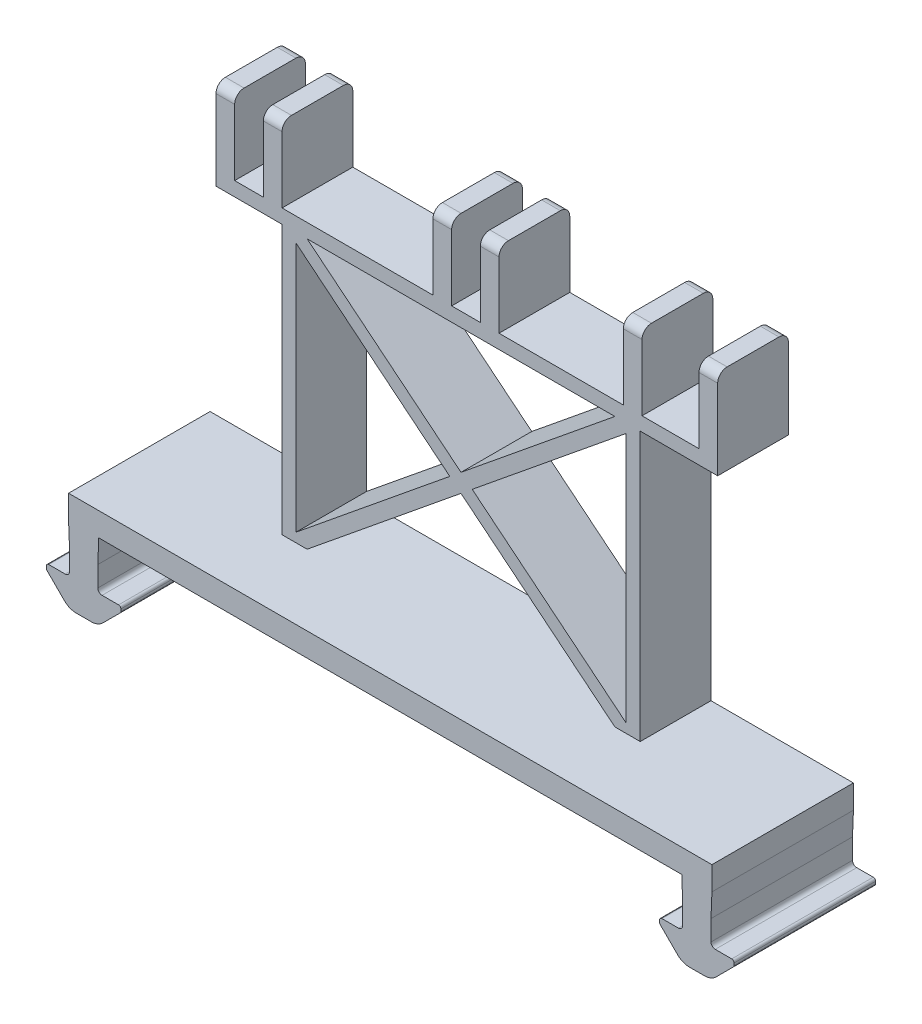
from build123d import *

# Parameters (mm, degrees)
BOSS_EXTRUDE2_DEPTH  = 38.1
BOSS_EXTRUDE6_DEPTH  = 19.05
SKETCH6_W            = 5.08
SKETCH6_H            = 19.05
BOSS_EXTRUDE5_DEPTH  = 20.32
SKETCH10_W           = 20.64004
SKETCH10_H           = 3.81
SKETCH10_W_2         = 17.5006
CUT_EXTRUDE3_DEPTH   = 19.05
FILLET1_R            = 2.54
BOSS_EXTRUDE7_DEPTH  = 19.05
CLEARANCE_START      = -38.1
SKETCH3_W            = 7.73176
SKETCH3_H            = 20.32
SKETCH3_W_2          = 7.7216
SKETCH3_W_3          = 15.3416
CLEARANCE_TRIM_DEPTH = 38.1


with BuildPart() as part:
    # Sketch1 → Boss-Extrude2 (new body)
    with BuildSketch(Plane.XY):
        with BuildLine():
            Line((-2.016886463, 6.858), (2.016886463, 6.858))
            ThreePointArc((2.016886463, 6.858), (3.83455623, 7.219556996), (5.375502252, 8.249184211))
            Line((5.375502252, 8.249184211), (10.026617928, 12.900299887))
            ThreePointArc((10.026617928, 12.900299887), (10.219328904, 13.188712244), (10.287, 13.528917816))
            Line((10.287, 13.528917816), (10.287, 14.097877816))
            ThreePointArc((10.287, 14.097877816), (10.026617928, 14.726495744), (9.398, 14.986877816))
            Line((9.398, 14.986877816), (4.953, 14.986877816))
            ThreePointArc((4.953, 14.986877816), (4.324382072, 15.247259887), (4.064, 15.875877816))
            Line((4.064, 15.875877816), (4.064, 27.686877816))
            Line((4.064, 27.686877816), (161.036, 27.686877816))
            Line((161.036, 27.686877816), (161.036, 15.875877816))
            ThreePointArc((161.036, 15.875877816), (160.775617928, 15.247259887), (160.147, 14.986877816))
            Line((160.147, 14.986877816), (155.702, 14.986877816))
            ThreePointArc((155.702, 14.986877816), (155.073382072, 14.726495744), (154.813, 14.097877816))
            Line((154.813, 14.097877816), (154.813, 13.528917816))
            ThreePointArc((154.813, 13.528917816), (154.880671096, 13.188712244), (155.073382072, 12.900299887))
            Line((155.073382072, 12.900299887), (159.724497748, 8.249184211))
            ThreePointArc((159.724497748, 8.249184211), (161.26544377, 7.219556996), (163.083113537, 6.858))
            Line((163.083113537, 6.858), (167.116886463, 6.858))
            ThreePointArc((167.116886463, 6.858), (168.93455623, 7.219556996), (170.475502252, 8.249184211))
            Line((170.475502252, 8.249184211), (175.126617928, 12.900299887))
            ThreePointArc((175.126617928, 12.900299887), (175.319328904, 13.188712244), (175.387, 13.528917816))
            Line((175.387, 13.528917816), (175.387, 14.097877816))
            ThreePointArc((175.387, 14.097877816), (175.126617928, 14.726495744), (174.498, 14.986877816))
            Line((174.498, 14.986877816), (170.053, 14.986877816))
            ThreePointArc((170.053, 14.986877816), (169.424382072, 15.247259887), (169.164, 15.875877816))
            Line((169.164, 15.875877816), (169.164, 27.686877816))
            Line((169.164, 27.686877816), (169.164, 34.036877816))
            Line((169.164, 34.036877816), (-4.064, 34.036877816))
            Line((-4.064, 34.036877816), (-4.064, 27.686877816))
            Line((-4.064, 27.686877816), (-4.064, 15.875877816))
            ThreePointArc((-4.064, 15.875877816), (-4.324382072, 15.247259887), (-4.953, 14.986877816))
            Line((-4.953, 14.986877816), (-9.398, 14.986877816))
            ThreePointArc((-9.398, 14.986877816), (-10.026617928, 14.726495744), (-10.287, 14.097877816))
            Line((-10.287, 14.097877816), (-10.287, 13.528917816))
            ThreePointArc((-10.287, 13.528917816), (-10.219328904, 13.188712244), (-10.026617928, 12.900299887))
            Line((-10.026617928, 12.900299887), (-5.375502252, 8.249184211))
            ThreePointArc((-5.375502252, 8.249184211), (-3.83455623, 7.219556996), (-2.016886463, 6.858))
        make_face()
    extrude(amount=BOSS_EXTRUDE2_DEPTH)

    # Sketch7 → Boss-Extrude6 (add)
    with BuildSketch(Plane.XY):
        Polygon((130.81, 106.426877816), (169.164, 106.426877816), (169.164, 110.236877816), (-4.064, 110.236877816), (-4.064, 106.426877816), (34.29, 106.426877816), (34.29, 34.036877816), (38.1, 34.036877816), (38.1, 106.426877816), (127, 106.426877816), (127, 34.036877816), (130.81, 34.036877816), align=None)
    extrude(amount=BOSS_EXTRUDE6_DEPTH)

    # Sketch6 → Boss-Extrude5 (add)
    with BuildSketch(Plane(origin=(0, 110.236877816, 0), x_dir=(1, 0, 0), z_dir=(0, 1, 0))):
        with Locations((19.11604, -9.525)):
            Rectangle(SKETCH6_W, SKETCH6_H)
        with Locations((31.8262, -9.525)):
            Rectangle(SKETCH6_W, SKETCH6_H)
        with Locations((77.5462, -9.525)):
            Rectangle(SKETCH6_W, SKETCH6_H)
        with Locations((90.2462, -9.525)):
            Rectangle(SKETCH6_W, SKETCH6_H)
        with Locations((128.8034, -9.525)):
            Rectangle(SKETCH6_W, SKETCH6_H)
        with Locations((149.1234, -9.525)):
            Rectangle(SKETCH6_W, SKETCH6_H)
    extrude(amount=BOSS_EXTRUDE5_DEPTH)

    # Sketch10 → Cut-Extrude3 (cut)
    with BuildSketch(Plane.XY):
        with Locations((6.25602, 108.331877816)):
            Rectangle(SKETCH10_W, SKETCH10_H)
        with Locations((160.4137, 108.331877816)):
            Rectangle(SKETCH10_W_2, SKETCH10_H)
    extrude(amount=CUT_EXTRUDE3_DEPTH, mode=Mode.SUBTRACT)

    # Fillet1
    fillet1_edges = [part.edges().sort_by_distance(p)[0] for p in [
        (19.11604, 130.556877816, 19.05),
        (19.11604, 130.556877816, 0),
        (31.8262, 130.556877816, 0),
        (31.8262, 130.556877816, 19.05),
        (77.5462, 130.556877816, 0),
        (77.5462, 130.556877816, 19.05),
        (90.2462, 130.556877816, 0),
        (90.2462, 130.556877816, 19.05),
        (128.8034, 130.556877816, 0),
        (128.8034, 130.556877816, 19.05),
        (149.1234, 130.556877816, 0),
        (149.1234, 130.556877816, 19.05),
    ]]
    fillet(fillet1_edges, radius=FILLET1_R)

    # Sketch11 → Boss-Extrude7 (add)
    with BuildSketch(Plane.XY):
        Polygon((38.1, 103.970194938), (79.533021028, 70.231877816), (38.1, 36.493560693), (38.1, 34.036877816), (41.116978972, 34.036877816), (82.55, 67.775194938), (123.983021028, 34.036877816), (127, 34.036877816), (127, 36.493560693), (85.566978972, 70.231877816), (127, 103.970194938), (127, 106.426877816), (123.983021028, 106.426877816), (82.55, 72.688560693), (41.116978972, 106.426877816), (38.1, 106.426877816), align=None)
    extrude(amount=BOSS_EXTRUDE7_DEPTH)

    # Sketch3 → Clearance Trim (cut)
    with BuildSketch(Plane.XY.offset(38.1).offset(CLEARANCE_START)):
        with BuildLine():
            Line((4.064, 27.686877816), (3.81, 21.336877816))
            Line((3.81, 21.336877816), (3.81, 15.875877816))
            ThreePointArc((3.81, 15.875877816), (4.144776949, 15.067654765), (4.953, 14.732877816))
            Line((4.953, 14.732877816), (9.398, 14.732877816))
            ThreePointArc((9.398, 14.732877816), (9.847012806, 14.546890622), (10.033, 14.097877816))
            Line((10.033, 14.097877816), (10.033, 13.528917816))
            ThreePointArc((10.033, 13.528917816), (9.984663503, 13.285913836), (9.847012806, 13.07990501))
            Line((9.847012806, 13.07990501), (5.19589713, 8.428789333))
            ThreePointArc((5.19589713, 8.428789333), (3.737354638, 7.454222398), (2.016886463, 7.112))
            Line((2.016886463, 7.112), (-2.016886463, 7.112))
            ThreePointArc((-2.016886463, 7.112), (-3.737354638, 7.454222398), (-5.19589713, 8.428789333))
            Line((-5.19589713, 8.428789333), (-9.847012806, 13.07990501))
            ThreePointArc((-9.847012806, 13.07990501), (-9.984663503, 13.285913836), (-10.033, 13.528917816))
            Line((-10.033, 13.528917816), (-10.033, 14.097877816))
            ThreePointArc((-10.033, 14.097877816), (-9.847012806, 14.546890622), (-9.398, 14.732877816))
            Line((-9.398, 14.732877816), (-4.953, 14.732877816))
            ThreePointArc((-4.953, 14.732877816), (-4.144776949, 15.067654765), (-3.81, 15.875877816))
            Line((-3.81, 15.875877816), (-3.81, 21.336877816))
            Line((-3.81, 21.336877816), (-4.064, 27.686877816))
            Line((-4.064, 27.686877816), (-4.064, 15.875877816))
            ThreePointArc((-4.064, 15.875877816), (-4.324382072, 15.247259887), (-4.953, 14.986877816))
            Line((-4.953, 14.986877816), (-9.398, 14.986877816))
            ThreePointArc((-9.398, 14.986877816), (-10.026617928, 14.726495744), (-10.287, 14.097877816))
            Line((-10.287, 14.097877816), (-10.287, 13.528917816))
            ThreePointArc((-10.287, 13.528917816), (-10.219328904, 13.188712244), (-10.026617928, 12.900299887))
            Line((-10.026617928, 12.900299887), (-5.375502252, 8.249184211))
            ThreePointArc((-5.375502252, 8.249184211), (-3.83455623, 7.219556996), (-2.016886463, 6.858))
            Line((-2.016886463, 6.858), (2.016886463, 6.858))
            ThreePointArc((2.016886463, 6.858), (3.83455623, 7.219556996), (5.375502252, 8.249184211))
            Line((5.375502252, 8.249184211), (10.026617928, 12.900299887))
            ThreePointArc((10.026617928, 12.900299887), (10.219328904, 13.188712244), (10.287, 13.528917816))
            Line((10.287, 13.528917816), (10.287, 14.097877816))
            ThreePointArc((10.287, 14.097877816), (10.026617928, 14.726495744), (9.398, 14.986877816))
            Line((9.398, 14.986877816), (4.953, 14.986877816))
            ThreePointArc((4.953, 14.986877816), (4.324382072, 15.247259887), (4.064, 15.875877816))
            Line((4.064, 15.875877816), (4.064, 27.686877816))
        make_face()
        with BuildLine():
            Line((161.036, 27.686877816), (161.29, 21.336877816))
            Line((161.29, 21.336877816), (161.29, 15.875877816))
            ThreePointArc((161.29, 15.875877816), (160.955223051, 15.067654765), (160.147, 14.732877816))
            Line((160.147, 14.732877816), (155.702, 14.732877816))
            ThreePointArc((155.702, 14.732877816), (155.252987194, 14.546890622), (155.067, 14.097877816))
            Line((155.067, 14.097877816), (155.067, 13.528917816))
            ThreePointArc((155.067, 13.528917816), (155.115336497, 13.285913836), (155.252987194, 13.07990501))
            Line((155.252987194, 13.07990501), (159.90410287, 8.428789333))
            ThreePointArc((159.90410287, 8.428789333), (161.362645362, 7.454222398), (163.083113537, 7.112))
            Line((163.083113537, 7.112), (167.116886463, 7.112))
            ThreePointArc((167.116886463, 7.112), (168.837354638, 7.454222398), (170.29589713, 8.428789333))
            Line((170.29589713, 8.428789333), (174.947012806, 13.07990501))
            ThreePointArc((174.947012806, 13.07990501), (175.084663503, 13.285913836), (175.133, 13.528917816))
            Line((175.133, 13.528917816), (175.133, 14.097877816))
            ThreePointArc((175.133, 14.097877816), (174.947012806, 14.546890622), (174.498, 14.732877816))
            Line((174.498, 14.732877816), (170.053, 14.732877816))
            ThreePointArc((170.053, 14.732877816), (169.244776949, 15.067654765), (168.91, 15.875877816))
            Line((168.91, 15.875877816), (168.91, 21.336877816))
            Line((168.91, 21.336877816), (169.164, 27.686877816))
            Line((169.164, 27.686877816), (169.164, 15.875877816))
            ThreePointArc((169.164, 15.875877816), (169.424382072, 15.247259887), (170.053, 14.986877816))
            Line((170.053, 14.986877816), (174.498, 14.986877816))
            ThreePointArc((174.498, 14.986877816), (175.126617928, 14.726495744), (175.387, 14.097877816))
            Line((175.387, 14.097877816), (175.387, 13.528917816))
            ThreePointArc((175.387, 13.528917816), (175.319328904, 13.188712244), (175.126617928, 12.900299887))
            Line((175.126617928, 12.900299887), (170.475502252, 8.249184211))
            ThreePointArc((170.475502252, 8.249184211), (168.93455623, 7.219556996), (167.116886463, 6.858))
            Line((167.116886463, 6.858), (163.083113537, 6.858))
            ThreePointArc((163.083113537, 6.858), (161.26544377, 7.219556996), (159.724497748, 8.249184211))
            Line((159.724497748, 8.249184211), (155.073382072, 12.900299887))
            ThreePointArc((155.073382072, 12.900299887), (154.880671096, 13.188712244), (154.813, 13.528917816))
            Line((154.813, 13.528917816), (154.813, 14.097877816))
            ThreePointArc((154.813, 14.097877816), (155.073382072, 14.726495744), (155.702, 14.986877816))
            Line((155.702, 14.986877816), (160.147, 14.986877816))
            ThreePointArc((160.147, 14.986877816), (160.775617928, 15.247259887), (161.036, 15.875877816))
            Line((161.036, 15.875877816), (161.036, 27.686877816))
        make_face()
        with Locations((25.47112, 120.396877816)):
            Rectangle(SKETCH3_W, SKETCH3_H)
        with Locations((83.8962, 120.396877816)):
            Rectangle(SKETCH3_W_2, SKETCH3_H)
        with Locations((138.9634, 120.396877816)):
            Rectangle(SKETCH3_W_3, SKETCH3_H)
    extrude(amount=CLEARANCE_TRIM_DEPTH, mode=Mode.SUBTRACT)


solid = part.part
